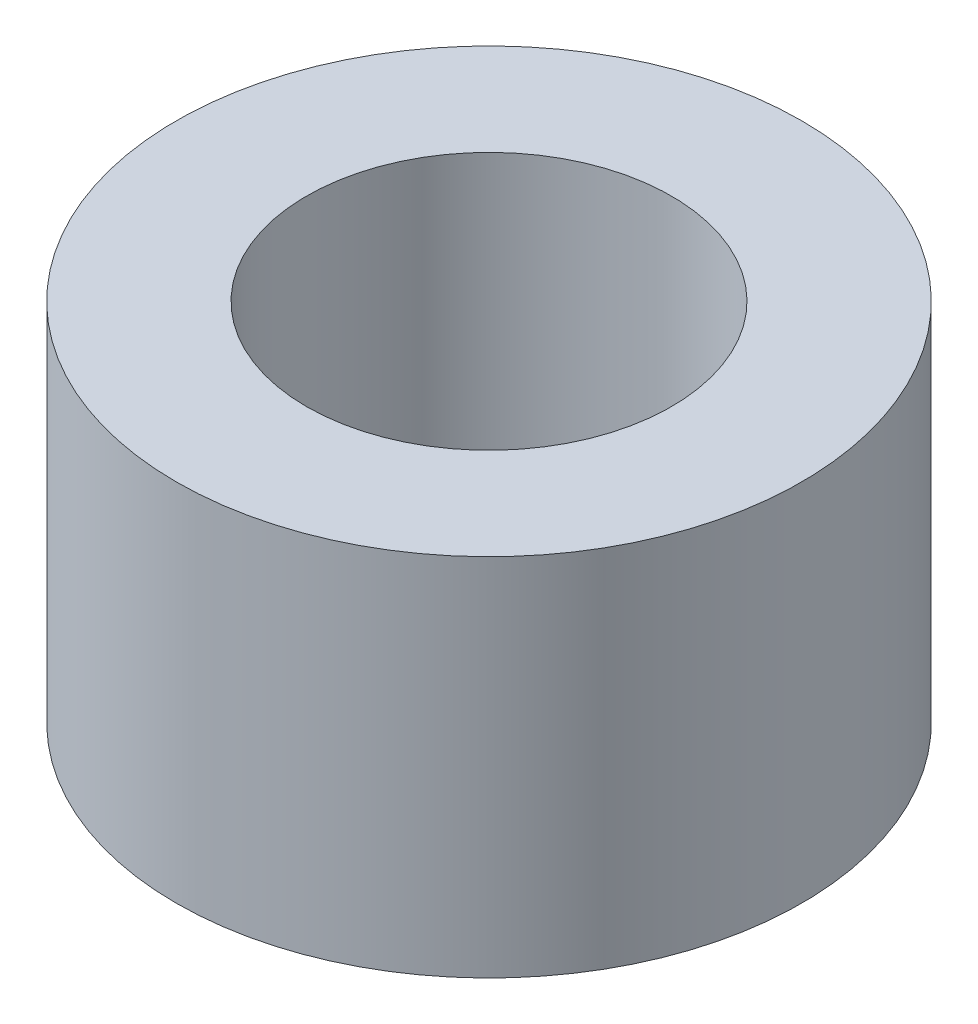
from build123d import *

# Parameters (mm, degrees)
SKETCH1_R           = 3
SKETCH1_R_2         = 1.75
BOSS_EXTRUDE1_DEPTH = 3.5


with BuildPart() as part:
    # Sketch1 → Boss-Extrude1 (new body)
    with BuildSketch(Plane(origin=(0, 0, 0), x_dir=(1, 0, 0), z_dir=(0, 1, 0))):
        with Locations(Location((0, 0, 0), (0, 0, 270))):
            Circle(SKETCH1_R)
        with Locations(Location((0, 0, 0), (0, 0, 270))):
            Circle(SKETCH1_R_2, mode=Mode.SUBTRACT)
    extrude(amount=BOSS_EXTRUDE1_DEPTH)


solid = part.part
